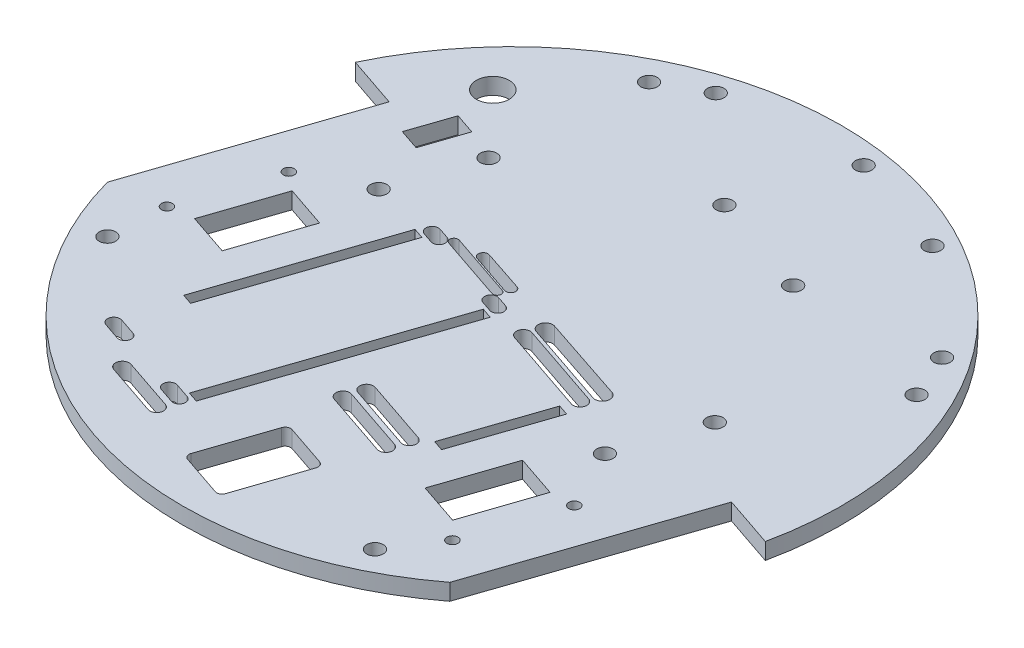
from build123d import *

# Parameters (mm, degrees)
CROQUIS1_R              = 1
CROQUIS1_R_2            = 1.5
CROQUIS1_R_3            = 3
SALIENTE_EXTRUIR1_DEPTH = 3


with BuildPart() as part:
    # Croquis1 → Saliente-Extruir1 (new body)
    with BuildSketch(Plane(origin=(0, 0, 0), x_dir=(1, 0, 0), z_dir=(0, 1, 0))):
        with BuildLine():
            Line((-54.220965168, 25.692157096), (-44.912977861, 22.539152286))
            Line((-44.912977861, 22.539152286), (-57.890214642, -15.770955858))
            ThreePointArc((-57.890214642, -15.770955858), (-19.250061989, -56.828119038), (36.387638976, -47.706810098))
            Line((36.387638976, -47.706810098), (49.364875757, -9.396701954))
            Line((49.364875757, -9.396701954), (58.672863064, -12.549706764))
            ThreePointArc((58.672863064, -12.549706764), (19.250061989, 56.828119038), (-54.220965168, 25.692157096))
        make_face()
        with Locations(Location((-48.627206238, -14.202170607, 0), (0, 0, 270))):
            Circle(CROQUIS1_R, mode=Mode.SUBTRACT)
        with Locations(Location((-43.012604824, 2.372697446, 0), (0, 0, 270))):
            Circle(CROQUIS1_R, mode=Mode.SUBTRACT)
        with Locations(Location((35.599626512, -24.256554973, 0), (0, 0, 90))):
            Circle(CROQUIS1_R, mode=Mode.SUBTRACT)
        with Locations(Location((29.985025098, -40.831423025, 0), (0, 0, 90))):
            Circle(CROQUIS1_R, mode=Mode.SUBTRACT)
        with Locations(Location((-24.357390716, 49.312447896, 0), (0, 0, 270))):
            Circle(CROQUIS1_R_2, mode=Mode.SUBTRACT)
        with Locations(Location((49.312447896, 24.357390716, 0), (0, 0, 270))):
            Circle(CROQUIS1_R_2, mode=Mode.SUBTRACT)
        with Locations(Location((24.357390716, -49.312447896, 0), (0, 0, 270))):
            Circle(CROQUIS1_R_2, mode=Mode.SUBTRACT)
        with Locations(Location((-49.312447896, -24.357390716, 0), (0, 0, 270))):
            Circle(CROQUIS1_R_2, mode=Mode.SUBTRACT)
        with Locations(Location((-32.085428511, 7.800903466, 0), (0, 0, 270))):
            Circle(CROQUIS1_R_2, mode=Mode.SUBTRACT)
        with Locations(Location((30.220997798, -13.304890445, 0), (0, 0, 90))):
            Circle(CROQUIS1_R_2, mode=Mode.SUBTRACT)
        with Locations(Location((45.752512271, 32.552062119, 0), (0, 0, 270))):
            Circle(CROQUIS1_R_2, mode=Mode.SUBTRACT)
        with Locations(Location((-16.551981469, 53.657201388, 0), (0, 0, 270))):
            Circle(CROQUIS1_R_2, mode=Mode.SUBTRACT)
        with Locations(Location((35.282961094, 1.644894083, 0), (0, 0, 270))):
            Circle(CROQUIS1_R_2, mode=Mode.SUBTRACT)
        with Locations(Location((-27.019600078, 22.74937871, 0), (0, 0, 270))):
            Circle(CROQUIS1_R_2, mode=Mode.SUBTRACT)
        with Locations(Location((8.315068564, 55.715649476, 0), (0, 0, 270))):
            Circle(CROQUIS1_R_2, mode=Mode.SUBTRACT)
        with Locations(Location((27.25777491, 49.298962147, 0), (0, 0, 270))):
            Circle(CROQUIS1_R_2, mode=Mode.SUBTRACT)
        with Locations(Location((20.841087581, 30.356255801, 0), (0, 0, 270))):
            Circle(CROQUIS1_R_2, mode=Mode.SUBTRACT)
        with Locations(Location((1.898381235, 36.77294313, 0), (0, 0, 270))):
            Circle(CROQUIS1_R_2, mode=Mode.SUBTRACT)
        with Locations(Location((-37.36617256, 33.867636702, 0), (0, 0, 270))):
            Circle(CROQUIS1_R_3, mode=Mode.SUBTRACT)
        Polygon((31.329833693, -24.393920483), (26.838152562, -37.653814925), (19.261070024, -35.087139993), (23.752751155, -21.827245551), align=None, mode=Mode.SUBTRACT)
        with BuildLine():
            Line((-2.242259213, -26.971782408), (9.596932254, -30.982211989))
            ThreePointArc((9.596932254, -30.982211989), (10.379806837, -32.567178833), (8.79483686, -33.350047072))
            Line((8.79483686, -33.350047072), (-3.029342655, -29.344597153))
            ThreePointArc((-3.029342655, -29.344597153), (-3.829733257, -27.762151967), (-2.242259213, -26.971782408))
        make_face(mode=Mode.SUBTRACT)
        with BuildLine():
            Line((4.686376156, -0.283162711), (20.314364649, -5.577019828))
            ThreePointArc((20.314364649, -5.577019828), (22.050140606, -4.71913044), (21.192235329, -2.983362336))
            Line((21.192235329, -2.983362336), (5.531032931, 2.233688827))
            ThreePointArc((5.531032931, 2.233688827), (3.853823576, 1.396401808), (4.686376156, -0.283162711))
        make_face(mode=Mode.SUBTRACT)
        Polygon((12.827287772, -26.900405501), (14.721558407, -27.542074234), (20.481483355, -10.538196491), (18.58721272, -9.896527758), align=None, mode=Mode.SUBTRACT)
        Polygon((-44.196996235, -13.591237439), (-36.619913697, -16.15791237), (-32.128232566, -2.898017928), (-39.705315105, -0.331342996), align=None, mode=Mode.SUBTRACT)
        with BuildLine():
            Line((-27.816509098, -44.714655504), (-18.345155925, -47.922999169))
            ThreePointArc((-18.345155925, -47.922999169), (-16.760193821, -47.14012298), (-17.543070009, -45.555160876))
            Line((-17.543070009, -45.555160876), (-27.014423182, -42.346817211))
            ThreePointArc((-27.014423182, -42.346817211), (-28.599385287, -43.129693399), (-27.816509098, -44.714655504))
        make_face(mode=Mode.SUBTRACT)
        Polygon((-20.550996192, 4.141245501), (-22.445266826, 4.782914234), (-33.101695464, -26.675934859), (-31.207424829, -27.317603592), align=None, mode=Mode.SUBTRACT)
        with BuildLine():
            Line((-35.583265447, -38.380985707), (-32.483875307, -39.430878847))
            ThreePointArc((-32.483875307, -39.430878847), (-31.034585959, -38.71501686), (-31.750447946, -37.265727512))
            Line((-31.750447946, -37.265727512), (-34.849838086, -36.215834372))
            ThreePointArc((-34.849838086, -36.215834372), (-36.299127434, -36.931696359), (-35.583265447, -38.380985707))
        make_face(mode=Mode.SUBTRACT)
        Polygon((-1.74088879, -2.230525018), (-12.397317428, -33.68937411), (-15.282344998, -42.206265656), (-17.176615633, -41.564596923), (-14.291588062, -33.047705377), (-3.635159425, -1.588856285), align=None, mode=Mode.SUBTRACT)
        Polygon((-35.216834792, 17.75393043), (-32.65015986, 25.331012969), (-36.438701129, 26.614350435), (-39.005376061, 19.037267896), align=None, mode=Mode.SUBTRACT)
        with BuildLine():
            Line((-7.485817773, -50.925076541), (-3.314971008, -38.612317416))
            ThreePointArc((-3.314971008, -38.612317416), (-2.810697341, -38.036561821), (-2.047001325, -37.986016465))
            Line((-2.047001325, -37.986016465), (5.530081214, -40.552691397))
            ThreePointArc((5.530081214, -40.552691397), (6.105836809, -41.056965065), (6.156382165, -41.820661081))
            Line((6.156382165, -41.820661081), (1.9855354, -54.133420206))
            ThreePointArc((1.9855354, -54.133420206), (1.481261732, -54.709175801), (0.717565717, -54.759721157))
            Line((0.717565717, -54.759721157), (-6.859516822, -52.193046225))
            ThreePointArc((-6.859516822, -52.193046225), (-7.435272417, -51.688772557), (-7.485817773, -50.925076541))
        make_face(mode=Mode.SUBTRACT)
        with BuildLine():
            Line((-1.151422367, -23.751522329), (10.6877691, -27.76195191))
            ThreePointArc((10.6877691, -27.76195191), (11.470645288, -29.346914015), (9.885683184, -30.129790204))
            Line((9.885683184, -30.129790204), (-1.953508283, -26.119360623))
            ThreePointArc((-1.953508283, -26.119360623), (-2.736384471, -24.534398518), (-1.151422367, -23.751522329))
        make_face(mode=Mode.SUBTRACT)
        with BuildLine():
            Line((3.691828695, -3.220011933), (19.319561431, -8.51377898))
            ThreePointArc((19.319561431, -8.51377898), (20.904523535, -7.730902791), (20.121647347, -6.145940687))
            Line((20.121647347, -6.145940687), (4.493914611, -0.85217364))
            ThreePointArc((4.493914611, -0.85217364), (2.908952507, -1.635049828), (3.691828695, -3.220011933))
        make_face(mode=Mode.SUBTRACT)
        with BuildLine():
            Line((-20.18129085, 7.087192335), (-18.287020215, 6.445523602))
            ThreePointArc((-18.287020215, 6.445523602), (-17.571158228, 4.996234254), (-19.020447577, 4.280372267))
            Line((-19.020447577, 4.280372267), (-20.914718212, 4.922041))
            ThreePointArc((-20.914718212, 4.922041), (-21.630580198, 6.371330349), (-20.18129085, 7.087192335))
        make_face(mode=Mode.SUBTRACT)
        with BuildLine():
            Line((-4.03263369, 1.616966387), (-2.138363055, 0.975297654))
            ThreePointArc((-2.138363055, 0.975297654), (-1.422501068, -0.473991695), (-2.871790417, -1.189853682))
            Line((-2.871790417, -1.189853682), (-4.766061052, -0.548184949))
            ThreePointArc((-4.766061052, -0.548184949), (-5.481923038, 0.9011044), (-4.03263369, 1.616966387))
        make_face(mode=Mode.SUBTRACT)
        with BuildLine():
            Line((-19.544125985, -41.400519554), (-16.806910291, -42.327729053))
            ThreePointArc((-16.806910291, -42.327729053), (-16.091048304, -43.777018402), (-17.540337653, -44.492880389))
            Line((-17.540337653, -44.492880389), (-20.277553347, -43.56567089))
            ThreePointArc((-20.277553347, -43.56567089), (-20.993415333, -42.116381541), (-19.544125985, -41.400519554))
        make_face(mode=Mode.SUBTRACT)
        with BuildLine():
            Line((-12.233875617, 5.870044257), (-4.656823255, 3.303379547))
            ThreePointArc((-4.656823255, 3.303379547), (-3.514904412, 3.869424877), (-4.084170263, 5.009741653))
            Line((-4.084170263, 5.009741653), (-11.675589384, 7.533597029))
            ThreePointArc((-11.675589384, 7.533597029), (-12.784164712, 6.980177058), (-12.233875617, 5.870044257))
        make_face(mode=Mode.SUBTRACT)
        with BuildLine():
            Line((-16.734038691, 7.116277585), (-4.860468149, 3.108408302))
            ThreePointArc((-4.860468149, 3.108408302), (-4.389721673, 2.157935917), (-5.340194058, 1.687189441))
            Line((-5.340194058, 1.687189441), (-17.213764599, 5.695058723))
            ThreePointArc((-17.213764599, 5.695058723), (-17.684511076, 6.645531108), (-16.734038691, 7.116277585))
        make_face(mode=Mode.SUBTRACT)
    extrude(amount=SALIENTE_EXTRUIR1_DEPTH)


solid = part.part
